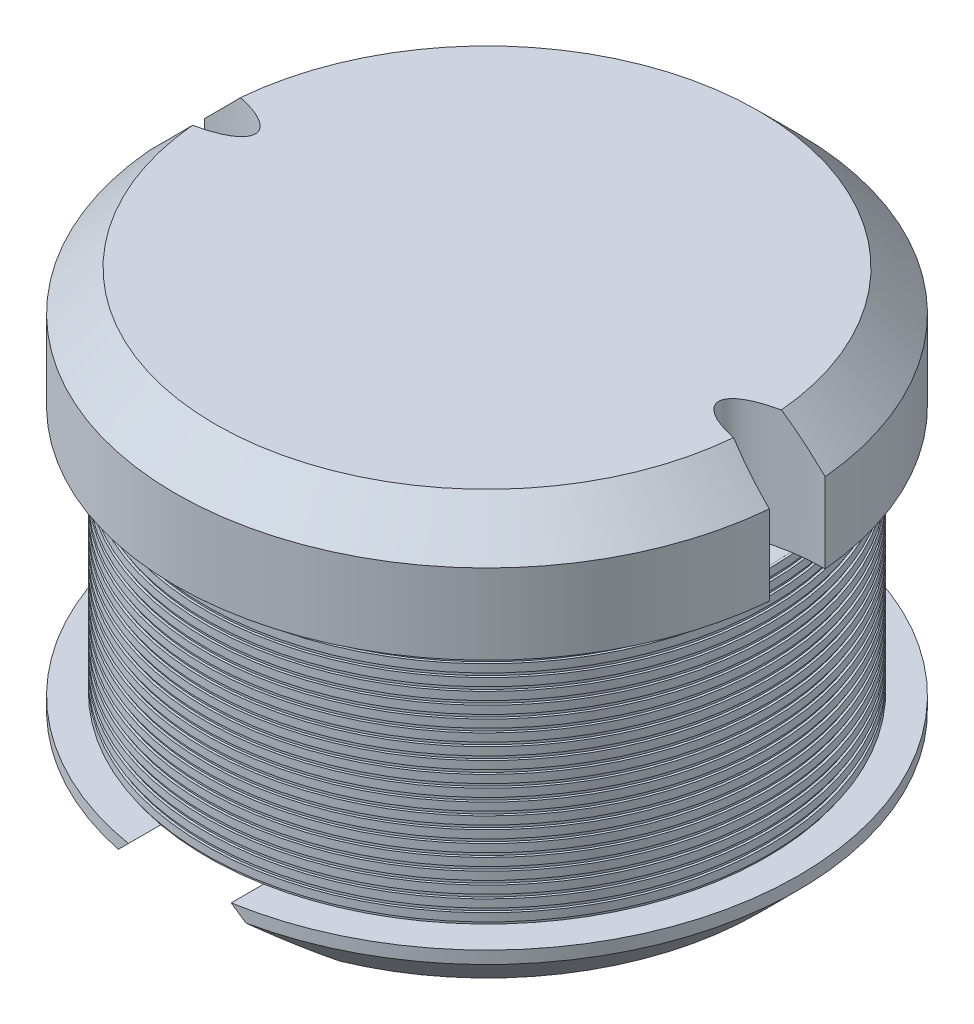
from build123d import *

# Parameters (mm, degrees)
SKETCH1_R               = 3.9
BOSS_EXTRUDE1_DEPTH     = 5.3
CHAMFER1_SIZE           = 0.5
CHAMFER2_SIZE           = 0.5
CUT_EXTRUDE2_DEPTH      = 8.649182963
CUT_EXTRUDE2_DEPTH_BACK = 8.649182963
SKETCH4_RX              = 1
SKETCH4_RY              = 0.35
CUT_EXTRUDE4_DEPTH      = 1.5
SKETCH5_W               = 0.8
SKETCH5_H               = 3.143672775
SKETCH6_W               = 0.03
SKETCH6_H               = 0.1


with BuildPart() as part:
    # Sketch1 → Boss-Extrude1 (new body)
    with BuildSketch(Plane(origin=(0, 0, 0), x_dir=(1, 0, 0), z_dir=(0, 1, 0))):
        with Locations(Location((0, 0, 0), (0, 0, 270))):
            Circle(SKETCH1_R)
    extrude(amount=BOSS_EXTRUDE1_DEPTH)

    # Chamfer1
    chamfer1_edges = [part.edges().sort_by_distance(p)[0] for p in [
        (0, 5.3, -3.9),
    ]]
    chamfer(chamfer1_edges, length=CHAMFER1_SIZE)

    # Chamfer2
    chamfer2_edges = [part.edges().sort_by_distance(p)[0] for p in [
        (0, 0, -3.9),
    ]]
    chamfer(chamfer2_edges, length=CHAMFER2_SIZE)

    # Sketch2 → Cut-Extrude2 (cut, two sides: drawn at the far end of the back side and taken through both)
    with BuildSketch(Plane.XY.offset(-CUT_EXTRUDE2_DEPTH_BACK)):
        Polygon((0, 0), (-1.3, 0), (-0.643672775, 0.656327225), (0.643672775, 0.656327225), (1.3, 0), align=None)
    extrude(amount=CUT_EXTRUDE2_DEPTH + CUT_EXTRUDE2_DEPTH_BACK, mode=Mode.SUBTRACT)

    # Sketch4 → Cut-Extrude4 (cut)
    with BuildSketch(Plane(origin=(0, 5.3, 0), x_dir=(1, 0, 0), z_dir=(0, 1, 0))):
        with Locations(Location((-3.9, 0), (0, 0, 180))):
            Ellipse(SKETCH4_RX, SKETCH4_RY)
        with Locations((3.9, 0)):
            Ellipse(SKETCH4_RX, SKETCH4_RY)
    extrude(amount=-CUT_EXTRUDE4_DEPTH, mode=Mode.SUBTRACT)

    # Sketch5 → Cut-Revolve1 (revolve, cut)
    with BuildSketch(Plane.XY, mode=Mode.PRIVATE) as cut_revolve1_sk:
        with Locations((-3.9, 2.228163613)):
            Rectangle(SKETCH5_W, SKETCH5_H)
    revolve(cut_revolve1_sk.sketch.rotate(Axis((0, -1000, 0), (0, 1, 0)), 174.778637909), axis=Axis((0, -1000, 0), (0, 1, 0)), mode=Mode.SUBTRACT)


with BuildPart() as body_2:
    # Sketch6 → Revolve1 (revolve)
    with BuildSketch(Plane.XY, mode=Mode.PRIVATE) as revolve1_sk:
        with Locations((-3.515, 3.6)):
            Rectangle(SKETCH6_W, SKETCH6_H)
        with Locations((-3.515, 3.75)):
            Rectangle(SKETCH6_W, SKETCH6_H)
        with Locations((-3.515, 3.45)):
            Rectangle(SKETCH6_W, SKETCH6_H)
        with Locations((-3.515, 3.3)):
            Rectangle(SKETCH6_W, SKETCH6_H)
        with Locations((-3.515, 3.15)):
            Rectangle(SKETCH6_W, SKETCH6_H)
        with Locations((-3.515, 3)):
            Rectangle(SKETCH6_W, SKETCH6_H)
        with Locations((-3.515, 2.85)):
            Rectangle(SKETCH6_W, SKETCH6_H)
        with Locations((-3.515, 2.7)):
            Rectangle(SKETCH6_W, SKETCH6_H)
        with Locations((-3.515, 2.55)):
            Rectangle(SKETCH6_W, SKETCH6_H)
        with Locations((-3.515, 2.4)):
            Rectangle(SKETCH6_W, SKETCH6_H)
        with Locations((-3.515, 2.25)):
            Rectangle(SKETCH6_W, SKETCH6_H)
        with Locations((-3.515, 2.1)):
            Rectangle(SKETCH6_W, SKETCH6_H)
        with Locations((-3.515, 1.95)):
            Rectangle(SKETCH6_W, SKETCH6_H)
        with Locations((-3.515, 1.8)):
            Rectangle(SKETCH6_W, SKETCH6_H)
        with Locations((-3.515, 1.65)):
            Rectangle(SKETCH6_W, SKETCH6_H)
        with Locations((-3.515, 1.5)):
            Rectangle(SKETCH6_W, SKETCH6_H)
        with Locations((-3.515, 1.35)):
            Rectangle(SKETCH6_W, SKETCH6_H)
        with Locations((-3.515, 1.2)):
            Rectangle(SKETCH6_W, SKETCH6_H)
        with Locations((-3.515, 1.05)):
            Rectangle(SKETCH6_W, SKETCH6_H)
        with Locations((-3.515, 0.9)):
            Rectangle(SKETCH6_W, SKETCH6_H)
        with Locations((-3.515, 0.75)):
            Rectangle(SKETCH6_W, SKETCH6_H)
    revolve(revolve1_sk.sketch.rotate(Axis((0, -1000, 0), (0, 1, 0)), 180), axis=Axis((0, -1000, 0), (0, 1, 0)))


solid = Compound([part.part, body_2.part])
